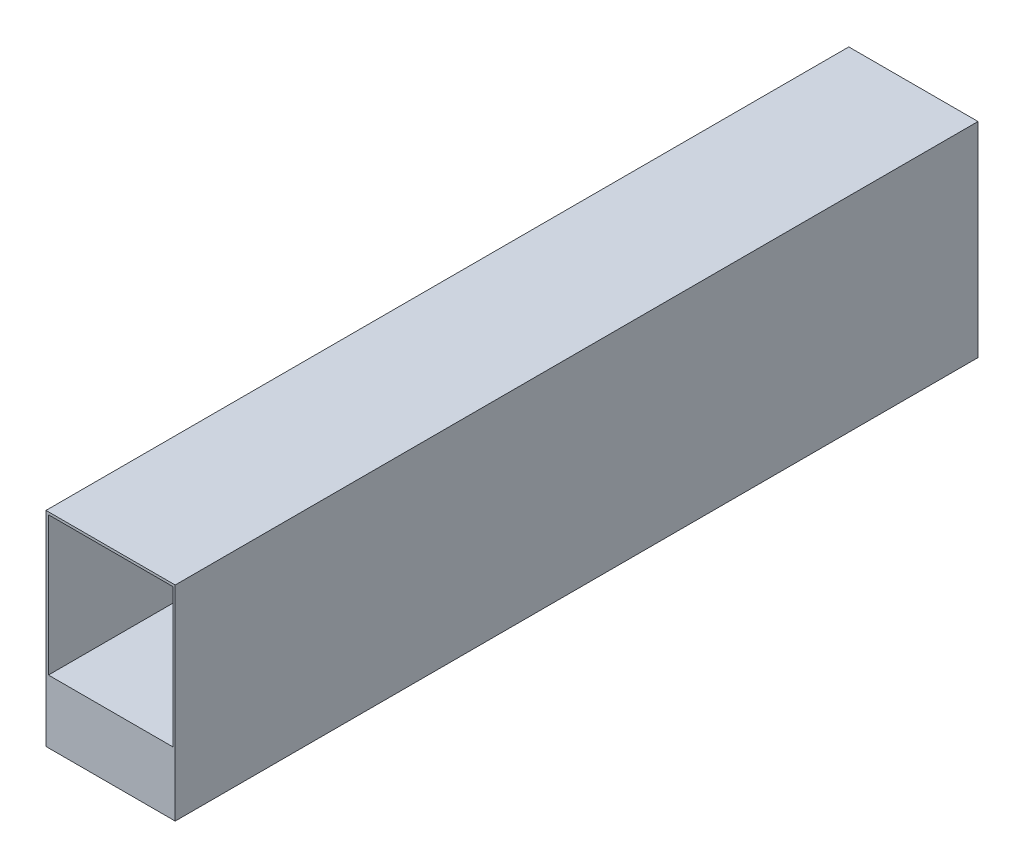
from build123d import *

# Parameters (mm, degrees)
SKETCH1_W      = 2599.944
SKETCH1_H      = 4114.8
EXTERIOR_DEPTH = 8077.2
SKETCH1_4_W    = 2501.9
SKETCH1_4_H    = 2794
INTERIOR_DEPTH = 8001
OPENING_REACH  = 16456.405
SKETCH3_W      = 2501.9
SKETCH3_H      = 2794


with BuildPart() as part:
    # Sketch1 → exterior (new, symmetric)
    with BuildSketch(Plane.XY):
        with Locations((0, 787.4)):
            Rectangle(SKETCH1_W, SKETCH1_H)
    extrude(amount=EXTERIOR_DEPTH, both=True)

    # Sketch1<4> → interior (cut, symmetric)
    with BuildSketch(Plane.XY):
        with Locations((0, 1397)):
            Rectangle(SKETCH1_4_W, SKETCH1_4_H)
    extrude(amount=INTERIOR_DEPTH, both=True, mode=Mode.SUBTRACT)

    # Sketch3 → opening (cut, up to next)
    with BuildSketch(Plane.XY.offset(8077.2), mode=Mode.PRIVATE) as opening_sk1:
        with Locations((0, 1397)):
            Rectangle(SKETCH3_W, SKETCH3_H)
    opening_tool1 = extrude(opening_sk1.sketch, amount=-OPENING_REACH, mode=Mode.PRIVATE) & part.part
    add(opening_tool1.solids().sort_by_distance((0, 1397, 8077.2))[0], mode=Mode.SUBTRACT)


solid = part.part
